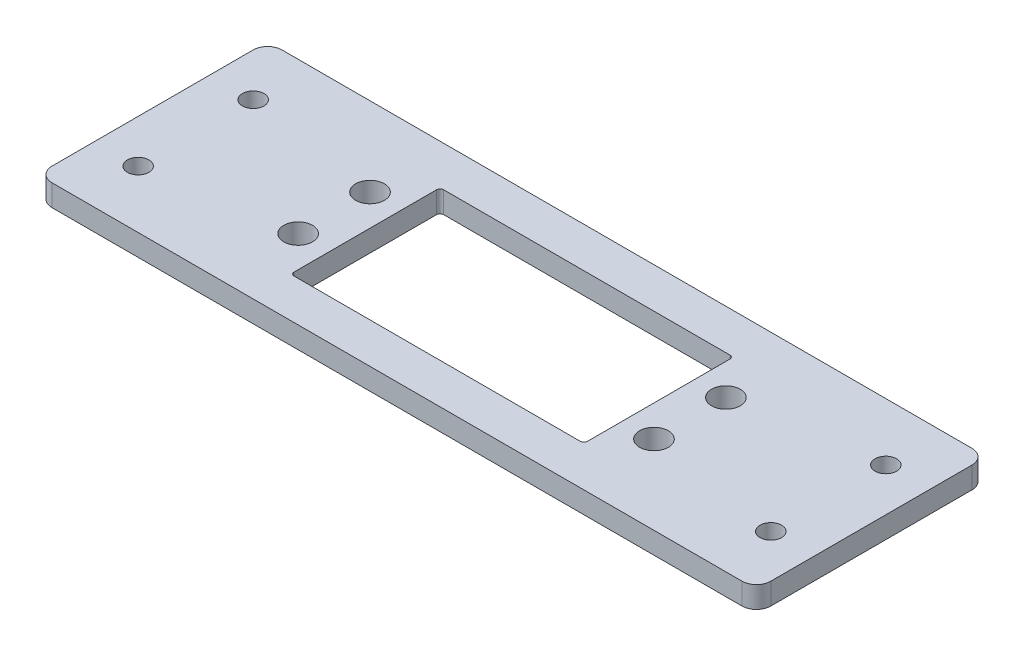
from build123d import *

# Parameters (mm, degrees)
SKETCH_1_W      = 100
SKETCH_1_H      = 32
SKETCH_1_R      = 2
SKETCH_1_R_2    = 1.5
SKETCH_1_W_2    = 40.8
SKETCH_1_H_2    = 20.8
EXTRUDE_1_DEPTH = 3
FILLET_1_R      = 0.5
FILLET_2_R      = 2


with BuildPart() as part:
    # 草图1 → 凸台-拉伸1 (new body)
    with BuildSketch(Plane(origin=(0, 0, 0), x_dir=(1, 0, 0), z_dir=(0, 1, 0))):
        Rectangle(SKETCH_1_W, SKETCH_1_H)
        with Locations(Location((24.75, 5, 0), (0, 0, 270))):
            Circle(SKETCH_1_R, mode=Mode.SUBTRACT)
        with Locations(Location((24.75, -5, 0), (0, 0, 90))):
            Circle(SKETCH_1_R, mode=Mode.SUBTRACT)
        with Locations(Location((-24.75, -5, 0), (0, 0, 270))):
            Circle(SKETCH_1_R, mode=Mode.SUBTRACT)
        with Locations(Location((-24.75, 5, 0), (0, 0, 90))):
            Circle(SKETCH_1_R, mode=Mode.SUBTRACT)
        with Locations(Location((-44, 8, 0), (0, 0, 270))):
            Circle(SKETCH_1_R_2, mode=Mode.SUBTRACT)
        with Locations(Location((44, 8, 0), (0, 0, 90))):
            Circle(SKETCH_1_R_2, mode=Mode.SUBTRACT)
        with Locations(Location((44, -8, 0), (0, 0, 270))):
            Circle(SKETCH_1_R_2, mode=Mode.SUBTRACT)
        with Locations(Location((-44, -8, 0), (0, 0, 90))):
            Circle(SKETCH_1_R_2, mode=Mode.SUBTRACT)
        Rectangle(SKETCH_1_W_2, SKETCH_1_H_2, mode=Mode.SUBTRACT)
    extrude(amount=EXTRUDE_1_DEPTH)

    # 圆角1
    fillet_1_edges = [part.edges().sort_by_distance(p)[0] for p in [
        (20.4, 1.5, 10.4),
        (20.4, 1.5, -10.4),
        (-20.4, 1.5, -10.4),
        (-20.4, 1.5, 10.4),
    ]]
    fillet(fillet_1_edges, radius=FILLET_1_R)

    # 圆角2
    fillet_2_edges = [part.edges().sort_by_distance(p)[0] for p in [
        (50, 1.5, 16),
        (-50, 1.5, 16),
        (-50, 1.5, -16),
        (50, 1.5, -16),
    ]]
    fillet(fillet_2_edges, radius=FILLET_2_R)


solid = part.part
